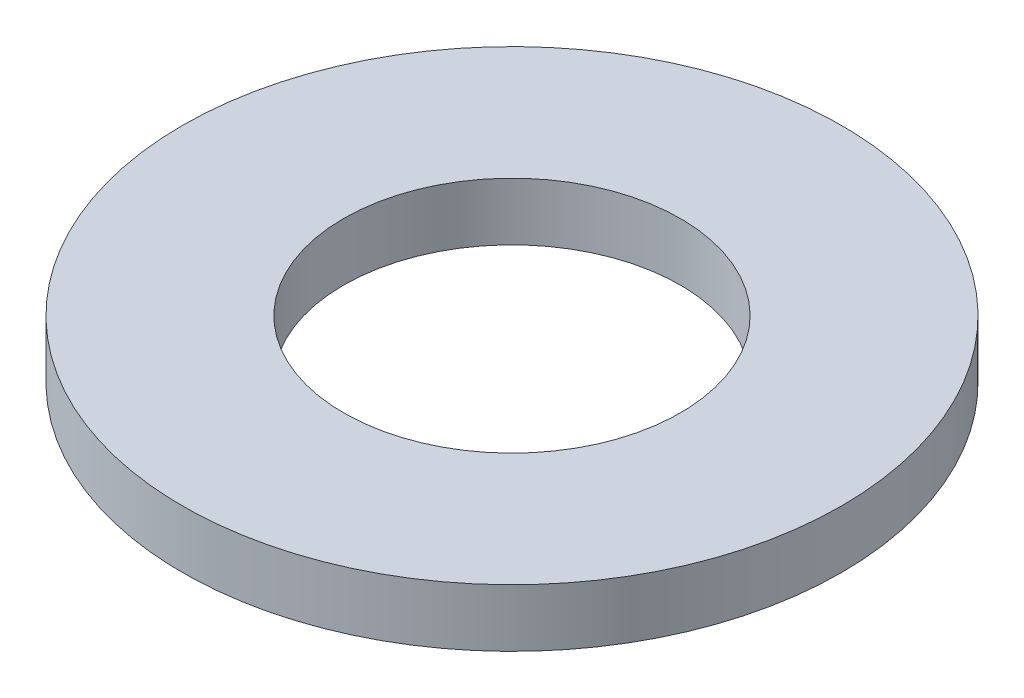
from build123d import *

# Parameters (mm, degrees)
ESBO_O2_W = 1.675
ESBO_O2_H = 0.6


with BuildPart() as part:
    # Esboço2 → Revolução1 (revolve)
    with BuildSketch(Plane.XY, mode=Mode.PRIVATE) as revolu_o1_sk:
        with Locations((2.5875, 0)):
            Rectangle(ESBO_O2_W, ESBO_O2_H)
    revolve(revolu_o1_sk.sketch.rotate(Axis((0, 35.417303371, 0), (0, -1, 0)), 180), axis=Axis((0, 35.417303371, 0), (0, -1, 0)))


solid = part.part
